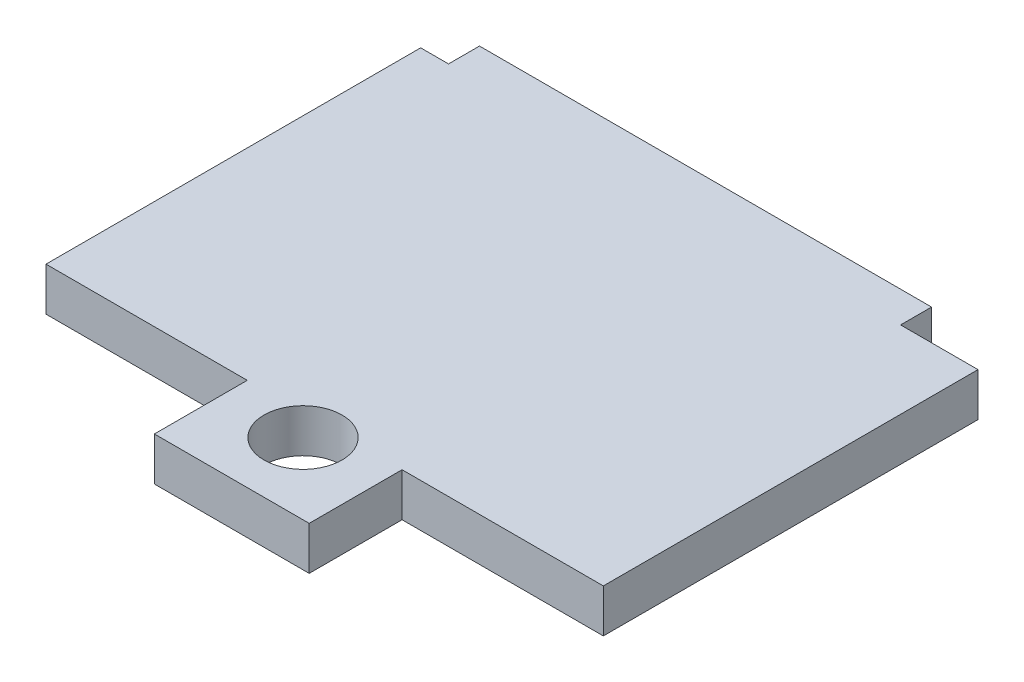
from build123d import *

# Parameters (mm, degrees)
BOSS_EXTRUDE1_DEPTH  = 1.778
M3_CLEARANCE_HOLE1_D = 3.2
SKETCH4_W            = 2.54
SKETCH4_H            = 9.144
BOSS_EXTRUDE2_DEPTH  = 0.508
CUT_EXTRUDE1_DEPTH   = 0.508


with BuildPart() as part:
    # Sketch1 → Boss-Extrude1 (new body)
    with BuildSketch(Plane(origin=(0, 0, 0), x_dir=(1, 0, 0), z_dir=(0, 1, 0))):
        Polygon((0, 15.367), (0, 0), (8.255, 0), (8.255, -3.81), (14.605, -3.81), (14.605, 0), (22.86, 0), (22.86, 15.367), (19.685, 15.367), (19.685, 16.637), (1.143, 16.637), (1.143, 15.367), align=None)
    extrude(amount=BOSS_EXTRUDE1_DEPTH)

    # M3 Clearance Hole1 (through all)
    with Locations(Plane(origin=(0, 1.778, 0), x_dir=(1, 0, 0), z_dir=(0, 1, 0))):
        with Locations((11.43, -0.888075369)):
            Hole(M3_CLEARANCE_HOLE1_D / 2)

    # Sketch4 → Boss-Extrude2 (add)
    with BuildSketch(Plane.XZ):
        with Locations((16.51, -8.874849992)):
            Rectangle(SKETCH4_W, SKETCH4_H)
        with Locations((1.27, -8.874849992)):
            Rectangle(SKETCH4_W, SKETCH4_H)
    extrude(amount=BOSS_EXTRUDE2_DEPTH)

    # Sketch5 → Cut-Extrude1 (cut)
    # profile 1 of 2: a face of its own
    with BuildSketch(Plane.XZ):
        with BuildLine():
            Line((7.098619447, -7.63856727), (6.654809351, -7.63856727))
            add(Edge.make_bspline(
                [(6.654809351, -7.63856727), (6.65689406, -7.593407206), (6.660971466, -7.505080318), (6.679077251, -7.376378172), (6.708407332, -7.255107921), (6.745428087, -7.140241516), (6.794812741, -7.033214847), (6.851792753, -6.932162167), (6.920580721, -6.839201339), (6.998314881, -6.75418531), (7.082698058, -6.676944938), (7.173410368, -6.610342032), (7.268918495, -6.553586522), (7.369241218, -6.50727365), (7.47457501, -6.471414477), (7.584619628, -6.445320656), (7.699726129, -6.429625843), (7.778191313, -6.427902489), (7.817970408, -6.427028809)],
                knots=[0, 0, 0, 0, 1.154964179, 2.258951466, 3.315045469, 4.34063582, 5.337653555, 6.322213479, 7.300594401, 8.285733883, 9.262436119, 10.219305053, 11.156568068, 12.097250375, 13.037875795, 13.995471444, 14.983774372, 16, 16, 16, 16], degree=3))
            add(Edge.make_bspline(
                [(7.817970408, -6.427028809), (7.859619206, -6.427880763), (7.941345665, -6.429552532), (8.060359073, -6.445284086), (8.172994369, -6.470651204), (8.279284534, -6.505293569), (8.379035914, -6.551550148), (8.472445213, -6.607330482), (8.558614534, -6.674376428), (8.63816929, -6.749396655), (8.708436711, -6.831919523), (8.771902624, -6.916762834), (8.824363345, -7.005647308), (8.868312206, -7.096949892), (8.902131547, -7.191419947), (8.92601466, -7.28867302), (8.940330597, -7.388775197), (8.94228457, -7.456463245), (8.943270889, -7.490630572)],
                knots=[0, 0, 0, 0, 1.156722346, 2.269809107, 3.328396062, 4.361258308, 5.3694338, 6.377253737, 7.377324894, 8.397019439, 9.4098266, 10.385180797, 11.337325354, 12.27255833, 13.196816462, 14.119704983, 15.050871513, 16, 16, 16, 16], degree=3))
            add(Edge.make_bspline(
                [(8.943270889, -7.490630572), (8.941476086, -7.538425055), (8.937911067, -7.633359276), (8.910459319, -7.773809008), (8.864309713, -7.909735021), (8.811002504, -8.020414445), (8.757088692, -8.109878201), (8.707612357, -8.183722497), (8.649490463, -8.263570598), (8.581476558, -8.348887994), (8.506275151, -8.441626781), (8.420898946, -8.539394585), (8.327990467, -8.644170785), (8.261729584, -8.714722234), (8.227425537, -8.751247559)],
                knots=[0, 0, 0, 0, 1.155755081, 2.295677249, 3.447123235, 4.6205014, 5.259503175, 5.973005395, 6.77029923, 7.648035671, 8.612336498, 9.658570495, 10.787814065, 12, 12, 12, 12], degree=3))
            Line((8.227425537, -8.751247559), (7.366447973, -9.612926245))
            Line((7.366447973, -9.612926245), (8.988142684, -9.612926245))
            Line((8.988142684, -9.612926245), (8.988142684, -10.016772398))
            Line((8.988142684, -10.016772398), (6.520193966, -10.016772398))
            Line((6.520193966, -10.016772398), (7.859336594, -8.538106533))
            add(Edge.make_bspline(
                [(7.859336594, -8.538106533), (7.891233197, -8.504089164), (7.952443359, -8.438809211), (8.038710417, -8.343249843), (8.116542617, -8.254906698), (8.18635491, -8.173843551), (8.246319199, -8.098970828), (8.298048642, -8.031390036), (8.340957652, -7.970782047), (8.385518863, -7.899441399), (8.429674452, -7.813923361), (8.467236813, -7.709603363), (8.48977607, -7.603070016), (8.492959871, -7.531399828), (8.49455294, -7.495538424)],
                knots=[0, 0, 0, 0, 1.341560447, 2.574479018, 3.703506985, 4.728875774, 5.651874962, 6.462761537, 7.177175968, 7.787249671, 8.88179658, 9.938774664, 10.968630673, 12, 12, 12, 12], degree=3))
            add(Edge.make_bspline(
                [(8.49455294, -7.495538424), (8.494160341, -7.473291367), (8.493383504, -7.429271059), (8.482792611, -7.364808596), (8.467873435, -7.302283595), (8.444798689, -7.242701268), (8.416997865, -7.184889397), (8.38222398, -7.129595329), (8.340466728, -7.077331974), (8.294015715, -7.02692344), (8.242639674, -6.981410244), (8.188374296, -6.940591563), (8.130552249, -6.907441485), (8.070754475, -6.878451161), (8.007122124, -6.857898918), (7.941219355, -6.842596717), (7.8725287, -6.831996573), (7.825723591, -6.831253873), (7.801844607, -6.830874963)],
                knots=[0, 0, 0, 0, 0.999432927, 1.977580462, 2.931018689, 3.885672852, 4.844657058, 5.812871023, 6.815890212, 7.849665183, 8.891901864, 9.898878619, 10.897592748, 11.885014695, 12.882178885, 13.896915602, 14.927050508, 16, 16, 16, 16], degree=3))
            add(Edge.make_bspline(
                [(7.801844607, -6.830874963), (7.779142978, -6.831340577), (7.734482913, -6.832256564), (7.668709913, -6.841707423), (7.605575976, -6.857095281), (7.544868125, -6.878439644), (7.486146661, -6.904772408), (7.430847425, -6.938886454), (7.378066565, -6.9785716), (7.327106308, -7.023112202), (7.280726598, -7.075367197), (7.239243391, -7.13471735), (7.202612082, -7.201227331), (7.171301311, -7.274780789), (7.145352546, -7.355570692), (7.124536539, -7.443498804), (7.108443754, -7.538603388), (7.101954797, -7.604629559), (7.098619447, -7.63856727)],
                knots=[0, 0, 0, 0, 0.911540883, 1.79324023, 2.663162255, 3.518366492, 4.375475705, 5.243419306, 6.122264358, 7.02676621, 7.957780629, 8.921596253, 9.930241338, 11.002848587, 12.128200329, 13.335197372, 14.630280975, 16, 16, 16, 16], degree=3))
        make_face()
    # profile 2 of 2: a face of its own
    with BuildSketch(Plane.XZ):
        with BuildLine():
            add(Edge.make_bspline(
                [(9.257373453, -8.268174642), (9.257707511, -8.212545428), (9.258356264, -8.104511322), (9.265346865, -7.947349368), (9.277406168, -7.799829279), (9.292895918, -7.661946677), (9.314325578, -7.53360683), (9.338845547, -7.414746316), (9.369028878, -7.305350512), (9.404284044, -7.205224213), (9.443868504, -7.112589141), (9.487391806, -7.026284956), (9.534578297, -6.945215913), (9.58510928, -6.869410248), (9.641373712, -6.800556804), (9.700068485, -6.736297551), (9.763397453, -6.677886879), (9.830780261, -6.625617216), (9.900484151, -6.578360443), (9.973333323, -6.538529284), (10.04763983, -6.50383255), (10.124351247, -6.475765903), (10.202911381, -6.453963469), (10.283601581, -6.438737615), (10.366038156, -6.428252442), (10.421903886, -6.427438094), (10.449981626, -6.427028809)],
                knots=[0, 0, 0, 0, 1.622528522, 3.151013738, 4.587225782, 5.939257941, 7.196658267, 8.381214254, 9.47772444, 10.503964975, 11.475138444, 12.414102326, 13.321377868, 14.209997518, 15.068075989, 15.912287155, 16.746865696, 17.577313739, 18.397854368, 19.200328723, 19.996378645, 20.787862277, 21.580050128, 22.371504404, 23.181529048, 24, 24, 24, 24], degree=3))
            add(Edge.make_bspline(
                [(10.449981626, -6.427028809), (10.480611375, -6.427835411), (10.541069058, -6.429427502), (10.630791176, -6.438091753), (10.71750512, -6.455596424), (10.802400648, -6.477547964), (10.884102662, -6.507556193), (10.964229579, -6.542064281), (11.040315138, -6.585772004), (11.114954463, -6.633582317), (11.185588392, -6.688717049), (11.253146942, -6.748624795), (11.315523792, -6.815350513), (11.374992691, -6.886598185), (11.428503227, -6.965158163), (11.479443704, -7.048279613), (11.524548244, -7.138032651), (11.567342611, -7.232829549), (11.604126915, -7.335190956), (11.637420227, -7.444532314), (11.664400814, -7.562215888), (11.686782118, -7.687875943), (11.704030089, -7.821724038), (11.716768156, -7.963442232), (11.723418653, -8.113163019), (11.724676377, -8.215584825), (11.725322171, -8.268174642)],
                knots=[0, 0, 0, 0, 0.875057392, 1.727207867, 2.570264412, 3.399251263, 4.229017074, 5.053828049, 5.887584622, 6.731829445, 7.583639997, 8.443960147, 9.308026848, 10.190032267, 11.091770676, 12.020167189, 12.972467704, 13.958579741, 14.989078804, 16.076606933, 17.221320015, 18.435081626, 19.720875061, 21.074561036, 22.497895074, 24, 24, 24, 24], degree=3))
            add(Edge.make_bspline(
                [(11.725322171, -8.268174642), (11.724669607, -8.320529943), (11.72339885, -8.422482983), (11.716843798, -8.571514953), (11.703775577, -8.712462393), (11.687685189, -8.845720907), (11.665115837, -8.970885781), (11.637635063, -9.088023138), (11.606817596, -9.197748854), (11.569144735, -9.299101274), (11.52742996, -9.39378622), (11.482172243, -9.482736712), (11.432328125, -9.566128039), (11.377137935, -9.643055418), (11.319231522, -9.715939439), (11.256093223, -9.782246982), (11.18887371, -9.843241911), (11.117735564, -9.898147432), (11.043493032, -9.947661184), (10.965680377, -9.989456774), (10.886259076, -10.026554522), (10.803455862, -10.054669131), (10.718949239, -10.078662644), (10.631316242, -10.094161172), (10.541370362, -10.10442252), (10.480626249, -10.105814003), (10.449981626, -10.106515988)],
                knots=[0, 0, 0, 0, 1.496607488, 2.914388442, 4.262485651, 5.541812885, 6.749953981, 7.895567619, 8.980172623, 10.005210728, 10.983286874, 11.936336572, 12.856292636, 13.757107149, 14.640766483, 15.514956722, 16.370989637, 17.232841377, 18.081413197, 18.918442167, 19.755471137, 20.583656588, 21.41504191, 22.264086897, 23.124254193, 24, 24, 24, 24], degree=3))
            add(Edge.make_bspline(
                [(10.449981626, -10.106515988), (10.421678824, -10.106035069), (10.365623107, -10.105082573), (10.282847845, -10.095740826), (10.202212862, -10.080236792), (10.123954986, -10.058507227), (10.047524366, -10.030919028), (9.973252451, -9.997499783), (9.901627411, -9.957033163), (9.83196571, -9.911565512), (9.765279073, -9.859849403), (9.70316507, -9.801397254), (9.64413028, -9.737605989), (9.589344221, -9.667787701), (9.537596197, -9.592393096), (9.490946124, -9.510711859), (9.447453119, -9.423616374), (9.407129641, -9.330435794), (9.370721342, -9.229551156), (9.341682445, -9.118988739), (9.314299047, -8.999954988), (9.294203575, -8.871245717), (9.276768155, -8.733831934), (9.266652872, -8.586821605), (9.258008583, -8.430702295), (9.257589045, -8.323343797), (9.257373453, -8.268174642)],
                knots=[0, 0, 0, 0, 0.82614074, 1.636230647, 2.42850654, 3.22151677, 4.005075515, 4.799112676, 5.596456327, 6.404618302, 7.226350817, 8.05679228, 8.892237205, 9.761873943, 10.645770802, 11.559890835, 12.505927976, 13.487073095, 14.523090282, 15.633895838, 16.822583925, 18.088023083, 19.435493537, 20.865857947, 22.389433785, 24, 24, 24, 24], degree=3))
        make_face()
        with BuildLine():
            add(Edge.make_bspline(
                [(9.706091402, -8.266772398), (9.706271633, -8.31375308), (9.706620547, -8.404704164), (9.71180137, -8.536314375), (9.719177463, -8.658864034), (9.73021091, -8.772319917), (9.744923651, -8.876850725), (9.762337639, -8.972312102), (9.782192198, -9.058886935), (9.806398241, -9.136717487), (9.833200616, -9.207633253), (9.863001407, -9.272920137), (9.893944593, -9.334057226), (9.928801148, -9.389832738), (9.965715102, -9.441008885), (10.005353013, -9.487390866), (10.046299868, -9.529995357), (10.104711323, -9.577303624), (10.179553905, -9.626764367), (10.272462063, -9.669653846), (10.366070314, -9.697965137), (10.429224179, -9.701111655), (10.460498453, -9.702669834)],
                knots=[0, 0, 0, 0, 1.564601651, 3.028951736, 4.386019676, 5.653114642, 6.824348509, 7.900668805, 8.88431448, 9.780488761, 10.613163047, 11.407444027, 12.169849642, 12.89344098, 13.595615509, 14.26934431, 14.924332585, 15.560171042, 16.769153194, 17.901006317, 18.960562374, 20, 20, 20, 20], degree=3))
            add(Edge.make_bspline(
                [(10.460498453, -9.702669834), (10.495938502, -9.700815488), (10.566598051, -9.697118335), (10.67066257, -9.670198389), (10.77044331, -9.62501705), (10.849505011, -9.573972351), (10.909239318, -9.52432515), (10.952378316, -9.482060514), (10.992140043, -9.434874964), (11.029676411, -9.383487021), (11.063616837, -9.327056051), (11.096343218, -9.266862826), (11.124837762, -9.201463214), (11.141306096, -9.155889819), (11.149701178, -9.132657815)],
                knots=[0, 0, 0, 0, 1.331887272, 2.655486065, 4.012646414, 5.436183829, 6.178803566, 6.930724497, 7.703763371, 8.496530827, 9.320959298, 10.178042319, 11.071218497, 12, 12, 12, 12], degree=3))
            add(Edge.make_bspline(
                [(11.149701178, -9.132657815), (11.159815315, -9.10213426), (11.180433683, -9.039909879), (11.206265665, -8.943030643), (11.227651367, -8.841375204), (11.246065647, -8.735484936), (11.260047638, -8.624826368), (11.26971213, -8.509506086), (11.275255823, -8.389523383), (11.27614976, -8.308144215), (11.276604223, -8.266772398)],
                knots=[0, 0, 0, 0, 0.877617242, 1.789083553, 2.735016418, 3.71249782, 4.722174671, 5.778575778, 6.870664861, 8, 8, 8, 8], degree=3))
            add(Edge.make_bspline(
                [(11.276604223, -8.266772398), (11.27649545, -8.225396346), (11.276283326, -8.144706116), (11.269978775, -8.026676052), (11.262354092, -7.914327182), (11.249200102, -7.808028467), (11.234478725, -7.707249422), (11.214286167, -7.612702556), (11.19262849, -7.523444), (11.165571743, -7.440576183), (11.135990647, -7.363263217), (11.104791087, -7.291247759), (11.071056626, -7.224472183), (11.033889223, -7.163774353), (10.994660522, -7.108153013), (10.953224164, -7.057942676), (10.908962713, -7.013425963), (10.847083701, -6.963232418), (10.767313886, -6.910991825), (10.667568395, -6.864108645), (10.564571191, -6.836469599), (10.495008296, -6.832730108), (10.460498453, -6.830874963)],
                knots=[0, 0, 0, 0, 1.353201578, 2.638969622, 3.865559904, 5.035676431, 6.141732754, 7.195734042, 8.19695873, 9.144657206, 10.044788335, 10.904062871, 11.710933862, 12.489720227, 13.229995877, 13.935715626, 14.616825307, 15.279494989, 16.538995736, 17.725922936, 18.871840505, 20, 20, 20, 20], degree=3))
            add(Edge.make_bspline(
                [(10.460498453, -6.830874963), (10.429233197, -6.832463587), (10.365872168, -6.835683036), (10.272121855, -6.863601131), (10.179548155, -6.906830682), (10.105207095, -6.95632566), (10.047278708, -7.003583755), (10.005772837, -7.045219209), (9.967426631, -7.091863277), (9.930421213, -7.142627491), (9.896631151, -7.198769856), (9.863812059, -7.259266226), (9.834896151, -7.325116107), (9.807702415, -7.396086204), (9.78375133, -7.474058999), (9.763038634, -7.5605017), (9.744529336, -7.655857528), (9.731189746, -7.760599294), (9.719976033, -7.874227539), (9.711583777, -7.996969264), (9.70668372, -8.128844173), (9.70629315, -8.219792923), (9.706091402, -8.266772398)],
                knots=[0, 0, 0, 0, 1.039778295, 2.107176824, 3.232337611, 4.43520669, 5.071253539, 5.720927637, 6.389866065, 7.081397607, 7.811854436, 8.571243718, 9.372887587, 10.205834777, 11.102302774, 12.088086757, 13.166194718, 14.33675119, 15.604261439, 16.970055543, 18.43488556, 20, 20, 20, 20], degree=3))
        make_face(mode=Mode.SUBTRACT)
    extrude(amount=-CUT_EXTRUDE1_DEPTH, mode=Mode.SUBTRACT)


solid = part.part
